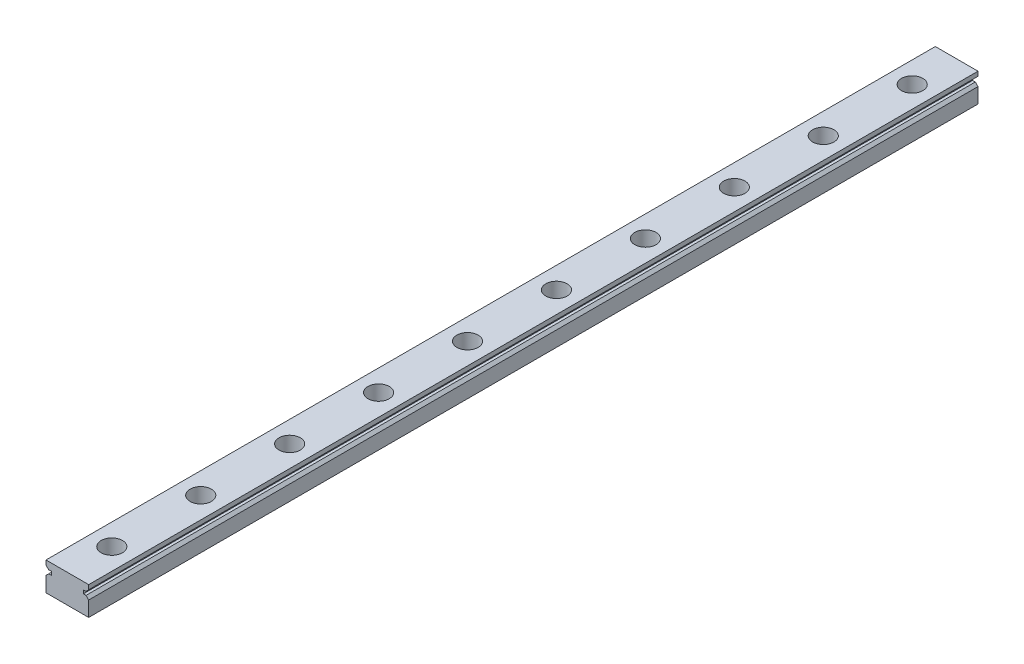
from build123d import *

# Parameters (mm, degrees)
BOSS_EXTRUDE1_DEPTH = 250
LPATTERN1_COUNT     = 10
LPATTERN1_PITCH     = 25


with BuildPart() as part:
    # Sketch1 → Boss-Extrude1 (new body)
    with BuildSketch(Plane.XY):
        Polygon((-6, 0), (6, 0), (6, 4.25), (5.25, 5), (4.5, 5), (4.5, 6), (5.25, 6), (6, 6.75), (6, 8), (-6, 8), (-6, 6.75), (-5.25, 6), (-4.5, 6), (-4.5, 5), (-5.25, 5), (-6, 4.25), align=None)
    extrude(amount=BOSS_EXTRUDE1_DEPTH)

    # Sketch2 → Cut-Revolve3 (revolve, cut)
    with BuildSketch(Plane(origin=(0, 0, 0), x_dir=(0, 0, -1), z_dir=(1, 0, 0))):
        Polygon((-10.75, 0), (-10.75, 3.5), (-9.5, 3.5), (-9.5, 8), (-12.5, 8), (-12.5, 0), align=None)
    cut_revolve3 = revolve(axis=Axis((0, 0, 12.5), (0, 1, 0)), mode=Mode.SUBTRACT)

    # LPattern1: Cut-Revolve3 ×10
    with Locations(*[(0, 0, i * LPATTERN1_PITCH) for i in range(1, LPATTERN1_COUNT)]):
        add(cut_revolve3, mode=Mode.SUBTRACT)


solid = part.part
